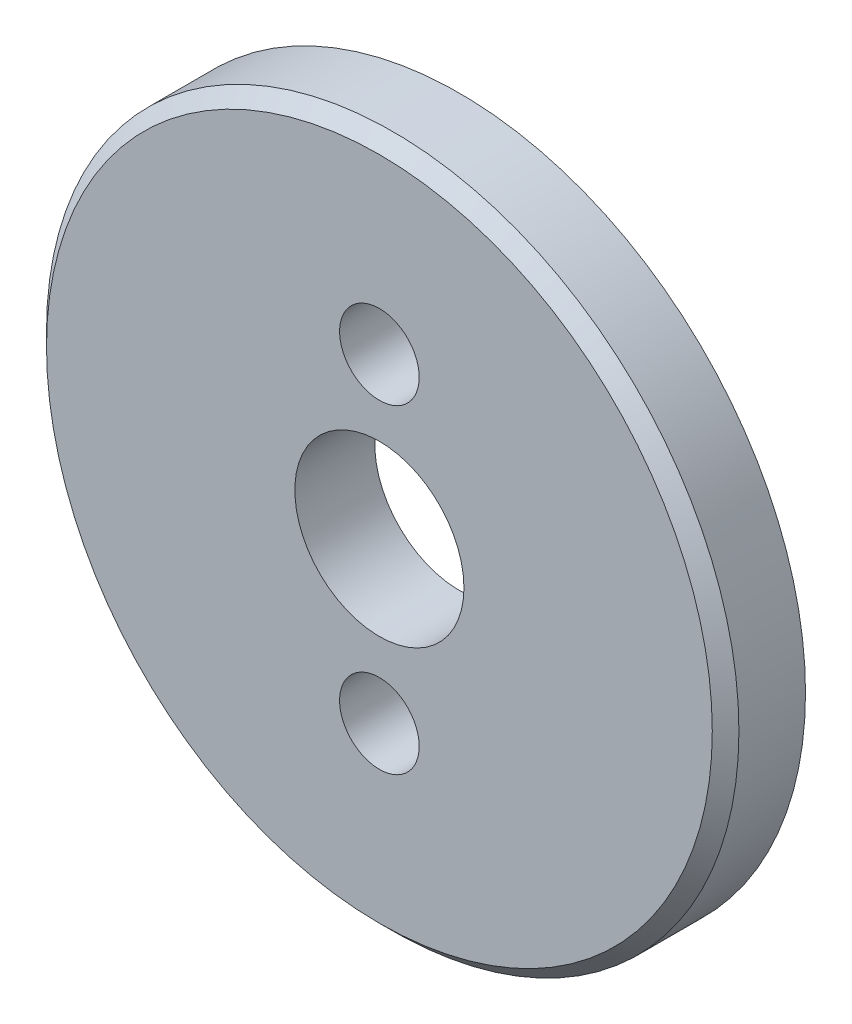
from build123d import *

# Parameters (mm, degrees)
SKETCH_1_R      = 13
SKETCH_1_R_2    = 3.175
SKETCH_1_R_3    = 1.494405319
EXTRUDE_1_DEPTH = 3
CHAMFER_1_SIZE  = 0.5


with BuildPart() as part:
    # Эскиз1 → Вытянуть1 (new body)
    with BuildSketch(Plane.XY):
        Circle(SKETCH_1_R)
        Circle(SKETCH_1_R_2, mode=Mode.SUBTRACT)
        with Locations((0, 6)):
            Circle(SKETCH_1_R_3, mode=Mode.SUBTRACT)
        with Locations((0, -6)):
            Circle(SKETCH_1_R_3, mode=Mode.SUBTRACT)
    extrude(amount=EXTRUDE_1_DEPTH)

    # Фаска1
    chamfer_1_edges = [part.edges().sort_by_distance(p)[0] for p in [
        (-13, 0, 3),
    ]]
    chamfer(chamfer_1_edges, length=CHAMFER_1_SIZE)


solid = part.part
